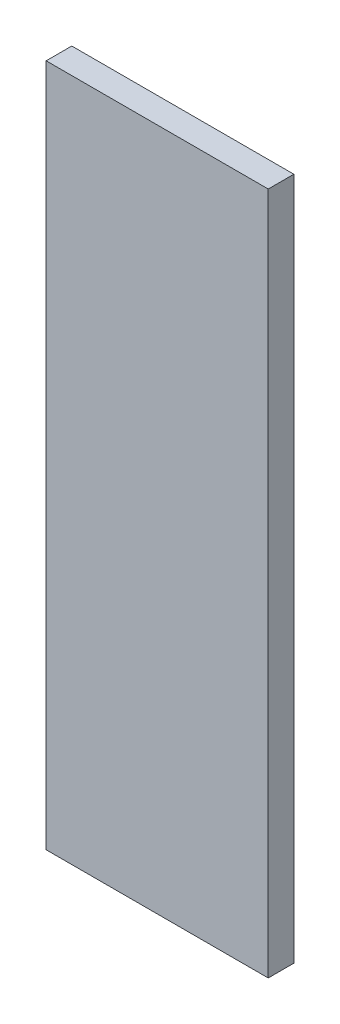
from build123d import *

# Parameters (mm, degrees)
SKETCH1_W           = 165.1
SKETCH1_H           = 508
BOSS_EXTRUDE1_DEPTH = 19.05


with BuildPart() as part:
    # Sketch1 → Boss-Extrude1 (new body)
    with BuildSketch(Plane.XY):
        with Locations((33.292567916, -164.059577714)):
            Rectangle(SKETCH1_W, SKETCH1_H)
    extrude(amount=BOSS_EXTRUDE1_DEPTH)


solid = part.part
